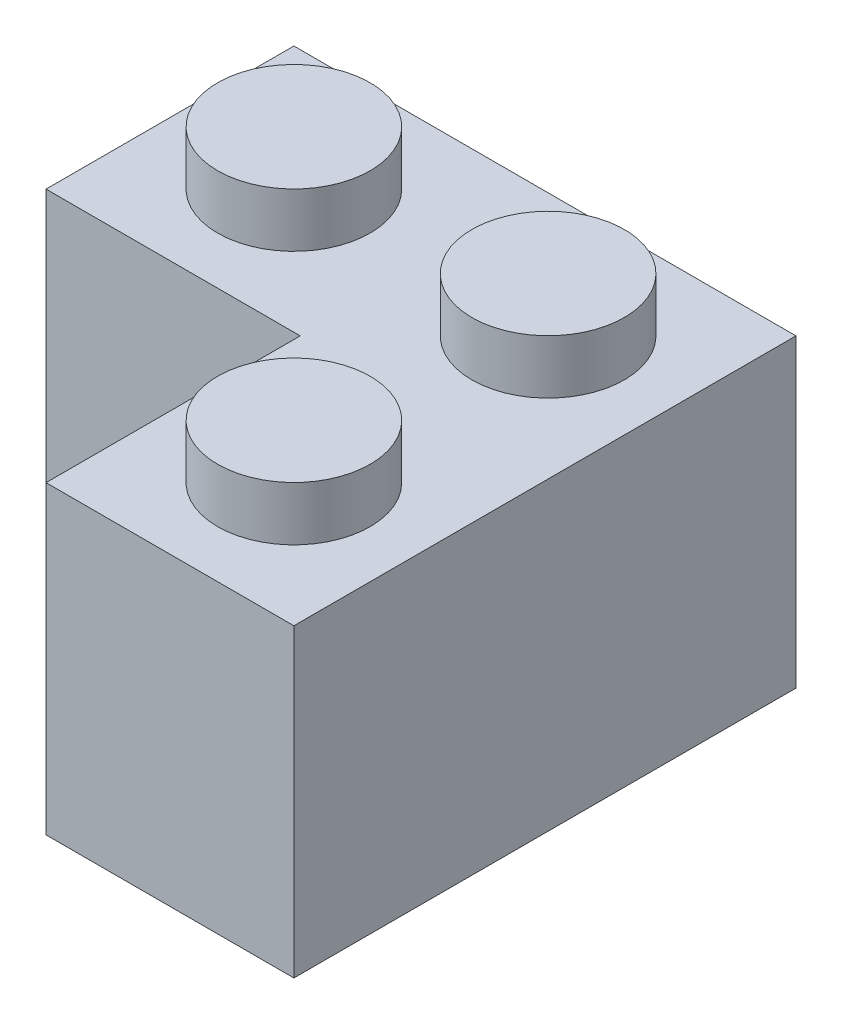
from build123d import *

# Parameters (mm, degrees)
SKETCH_2_W          = 15.8
SKETCH_2_H          = 15.8
EXTRUDE_1_DEPTH     = 9.6
SKETCH_3_W          = 8
SKETCH_3_H          = 8
CUT_EXTRUDE_1_DEPTH = 9.6
SKETCH_4_R          = 2.4
EXTRUDE_2_DEPTH     = 1.7
SKETCH_5_R          = 2.5
CUT_EXTRUDE_2_DEPTH = 1.8


with BuildPart() as part:
    # Эскиз2 → Бобышка-Вытянуть1 (new body)
    with BuildSketch(Plane(origin=(0, 0, 0), x_dir=(1, 0, 0), z_dir=(0, 1, 0))):
        Rectangle(SKETCH_2_W, SKETCH_2_H)
    extrude(amount=EXTRUDE_1_DEPTH)

    # Эскиз3 → Вырез-Вытянуть1 (cut)
    with BuildSketch(Plane(origin=(0, 9.6, 0), x_dir=(1, 0, 0), z_dir=(0, 1, 0))):
        with Locations((-3.9, -3.9)):
            Rectangle(SKETCH_3_W, SKETCH_3_H)
    extrude(amount=-CUT_EXTRUDE_1_DEPTH, mode=Mode.SUBTRACT)

    # Эскиз4 → Бобышка-Вытянуть2 (add)
    with BuildSketch(Plane(origin=(0, 9.6, 0), x_dir=(1, 0, 0), z_dir=(0, 1, 0))):
        with Locations(Location((-4, 4, 0), (0, 0, 270))):
            Circle(SKETCH_4_R)
        with Locations(Location((4, 4, 0), (0, 0, 270))):
            Circle(SKETCH_4_R)
        with Locations(Location((4, -4, 0), (0, 0, 270))):
            Circle(SKETCH_4_R)
    extrude(amount=EXTRUDE_2_DEPTH)

    # Эскиз5 → Вырез-Вытянуть2 (cut)
    with BuildSketch(Plane.XZ):
        with Locations(Location((-4, -4, 0), (0, 0, 270))):
            Circle(SKETCH_5_R)
        with Locations(Location((4, -4, 0), (0, 0, 270))):
            Circle(SKETCH_5_R)
        with Locations(Location((4, 4, 0), (0, 0, 270))):
            Circle(SKETCH_5_R)
    extrude(amount=-CUT_EXTRUDE_2_DEPTH, mode=Mode.SUBTRACT)


solid = part.part
